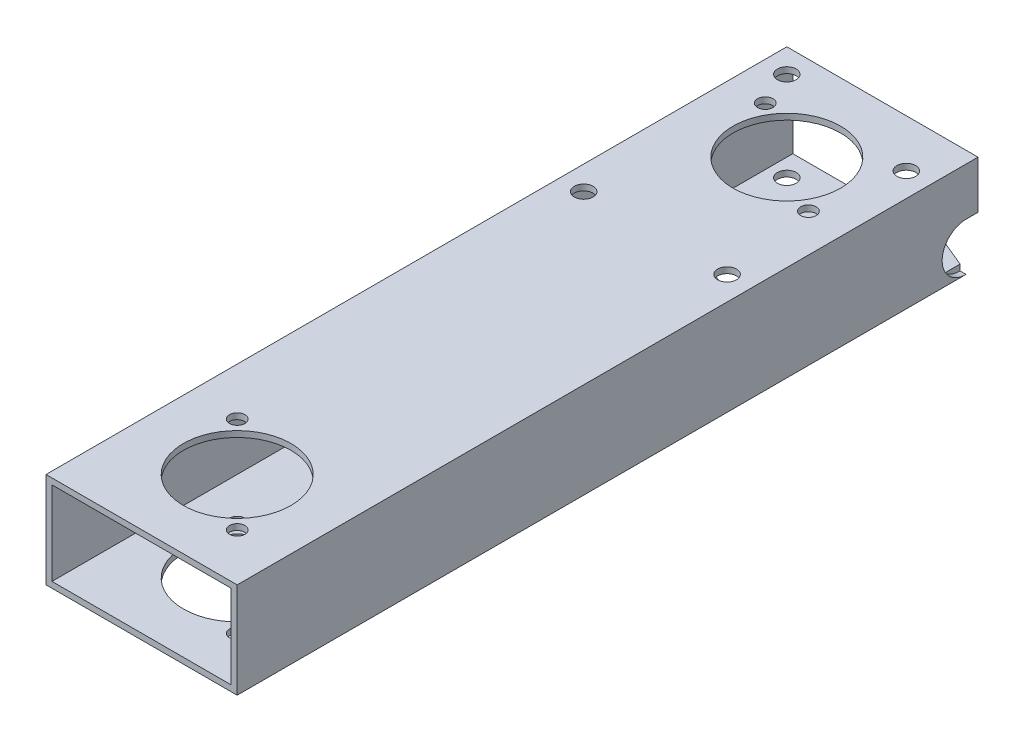
from build123d import *

# Parameters (mm, degrees)
BOSS_EXTRUDE1_DEPTH         = 98.424999
BOSS_EXTRUDE1_DEPTH_BACK    = 98.424999
SKETCH3_W                   = 50.8
SKETCH3_H                   = 25.4
SKETCH3_W_2                 = 47.625
SKETCH3_H_2                 = 22.225
SKETCH4_R                   = 14.2875
CUT_EXTRUDE3_DEPTH          = 105.774999061
CUT_EXTRUDE5_DEPTH          = 1.5875
CUT_EXTRUDE6_DEPTH          = 1.5875
F_10_CLEARANCE_HOLE1_D      = 4.9784
F_20_0_161_DIAMETER_HOLE1_D = 4.0894
F_20_0_161_DIAMETER_HOLE2_D = 4.0894


with BuildPart() as part:
    # Sketch3 → Boss-Extrude1 (new, two sides: drawn at the far end of the back side and taken through both)
    with BuildSketch(Plane.XY.offset(-BOSS_EXTRUDE1_DEPTH_BACK)):
        Rectangle(SKETCH3_W, SKETCH3_H)
        Rectangle(SKETCH3_W_2, SKETCH3_H_2, mode=Mode.SUBTRACT)
    extrude(amount=BOSS_EXTRUDE1_DEPTH + BOSS_EXTRUDE1_DEPTH_BACK)

    # Sketch4 → Cut-Extrude3 (cut, through all)
    with BuildSketch(Plane.XZ.offset(12.7)):
        with Locations((0, 73.025)):
            Circle(SKETCH4_R)
        with Locations((0, -73.025)):
            Circle(SKETCH4_R)
    extrude(amount=-CUT_EXTRUDE3_DEPTH, mode=Mode.SUBTRACT)

    # Sketch5 → Cut-Extrude5 (cut)
    with BuildSketch(Plane(origin=(25.4, 0, 0), x_dir=(0, 0, -1), z_dir=(1, 0, 0))):
        with BuildLine():
            Line((98.424999492, 0), (98.424999492, -12.7))
            Line((98.424999492, -12.7), (95.249999492, -12.7))
            ThreePointArc((95.249999492, -12.7), (88.899999492, -6.35), (95.249999492, 0))
            Line((95.249999492, 0), (98.424999492, 0))
        make_face()
    extrude(amount=-CUT_EXTRUDE5_DEPTH, mode=Mode.SUBTRACT)

    # Sketch6 → Cut-Extrude6 (cut)
    with BuildSketch(Plane.XZ.offset(12.7)):
        Polygon((23.8125, -98.424999492), (23.8125, -95.249999492), (16.1925, -98.424999492), align=None)
    extrude(amount=-CUT_EXTRUDE6_DEPTH, mode=Mode.SUBTRACT)

    # #10 Clearance Hole1 (through all)
    with Locations(Plane(origin=(0, -12.7, 0), x_dir=(-1, 0, 0), z_dir=(0, -1, 0))):
        with Locations((-19.05, 85.724999492), (19.05, 92.074999492), (19.05, 38.099999492), (-19.05, 38.099999492)):
            Hole(F_10_CLEARANCE_HOLE1_D / 2)

    # #20 (0.161) Diameter Hole1 (through all)
    with Locations(Plane(origin=(0, -12.7, 0), x_dir=(-1, 0, 0), z_dir=(0, -1, 0))):
        with Locations((15.293699364, 82.581564015), (-15.293699364, 63.468435985)):
            Hole(F_20_0_161_DIAMETER_HOLE1_D / 2)

    # #20 (0.161) Diameter Hole2 (through all)
    with Locations(Plane(origin=(0, 12.7, 0), x_dir=(1, 0, 0), z_dir=(0, 1, 0))):
        with Locations((-12.751963692, -60.273036308), (12.751963692, -85.776963692)):
            Hole(F_20_0_161_DIAMETER_HOLE2_D / 2)


solid = part.part
